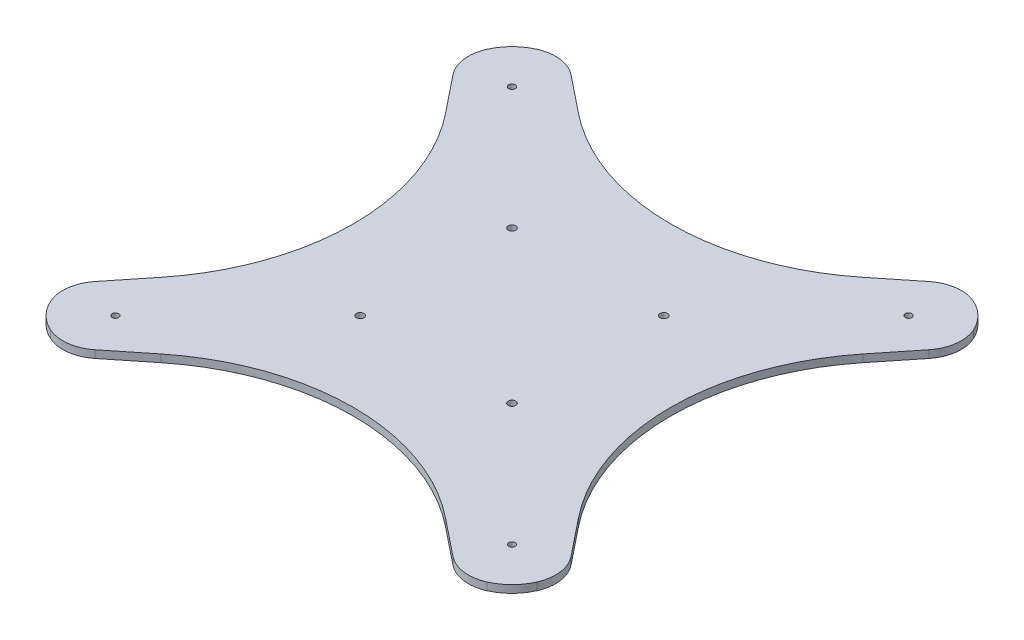
from build123d import *

# Parameters (mm, degrees)
EXTRUDE_3_DEPTH     = 4
FILLET_3_R          = 20
FILLET_4_R          = 20
FILLET_5_R          = 20
FILLET_6_R          = 20
FILLET_7_R          = 20
FILLET_8_R          = 20
FILLET_9_R          = 20
FILLET_10_R         = 20
SKETCH_6_R          = 1.75
CUT_EXTRUDE_3_DEPTH = 4
SKETCH_7_R          = 2
CUT_EXTRUDE_4_DEPTH = 4


with BuildPart() as part:
    # Эскиз5 → Бобышка-Вытянуть3 (new body)
    with BuildSketch(Plane(origin=(0, 0, 0), x_dir=(1, 0, 0), z_dir=(0, 1, 0))):
        with BuildLine():
            Line((-100, 130), (-74.963405707, 109.970724565))
            ThreePointArc((-74.963405707, 109.970724565), (0, 83.674981698), (74.963405707, 109.970724565))
            Line((74.963405707, 109.970724565), (100, 130))
            ThreePointArc((100, 130), (122.809833424, 122.809833424), (130, 100))
            Line((130, 100), (109.970724565, 74.963405707))
            ThreePointArc((109.970724565, 74.963405707), (83.674981698, 0), (109.970724565, -74.963405707))
            Line((109.970724565, -74.963405707), (130, -100))
            ThreePointArc((130, -100), (122.809833424, -122.809833424), (100, -130))
            Line((100, -130), (74.963405707, -109.970724565))
            ThreePointArc((74.963405707, -109.970724565), (0, -83.674981698), (-74.963405707, -109.970724565))
            Line((-74.963405707, -109.970724565), (-100, -130))
            ThreePointArc((-100, -130), (-122.809833424, -122.809833424), (-130, -100))
            Line((-130, -100), (-109.970724565, -74.963405707))
            ThreePointArc((-109.970724565, -74.963405707), (-83.674981698, 0), (-109.970724565, 74.963405707))
            Line((-109.970724565, 74.963405707), (-130, 100))
            ThreePointArc((-130, 100), (-122.809833424, 122.809833424), (-100, 130))
        make_face()
    extrude(amount=EXTRUDE_3_DEPTH)

    # Скругление3
    fillet_3_edges = [part.edges().sort_by_distance(p)[0] for p in [
        (130, 2, -100),
    ]]
    fillet(fillet_3_edges, radius=FILLET_3_R)

    # Скругление4
    fillet_4_edges = [part.edges().sort_by_distance(p)[0] for p in [
        (100, 2, -130),
    ]]
    fillet(fillet_4_edges, radius=FILLET_4_R)

    # Скругление5
    fillet_5_edges = [part.edges().sort_by_distance(p)[0] for p in [
        (-100, 2, -130),
    ]]
    fillet(fillet_5_edges, radius=FILLET_5_R)

    # Скругление6
    fillet_6_edges = [part.edges().sort_by_distance(p)[0] for p in [
        (-130, 2, -100),
    ]]
    fillet(fillet_6_edges, radius=FILLET_6_R)

    # Скругление7
    fillet_7_edges = [part.edges().sort_by_distance(p)[0] for p in [
        (-100, 2, 130),
    ]]
    fillet(fillet_7_edges, radius=FILLET_7_R)

    # Скругление8
    fillet_8_edges = [part.edges().sort_by_distance(p)[0] for p in [
        (-130, 2, 100),
    ]]
    fillet(fillet_8_edges, radius=FILLET_8_R)

    # Скругление9
    fillet_9_edges = [part.edges().sort_by_distance(p)[0] for p in [
        (100, 2, 130),
    ]]
    fillet(fillet_9_edges, radius=FILLET_9_R)

    # Скругление10
    fillet_10_edges = [part.edges().sort_by_distance(p)[0] for p in [
        (130, 2, 100),
    ]]
    fillet(fillet_10_edges, radius=FILLET_10_R)

    # Эскиз6 → Вырез-Вытянуть3 (cut)
    with BuildSketch(Plane(origin=(0, 4, 0), x_dir=(1, 0, 0), z_dir=(0, 1, 0))):
        with Locations(Location((-104.5, 104.5, 0), (0, 0, 270))):
            Circle(SKETCH_6_R)
        with Locations(Location((104.5, 104.5, 0), (0, 0, 270))):
            Circle(SKETCH_6_R)
        with Locations(Location((104.5, -104.5, 0), (0, 0, 270))):
            Circle(SKETCH_6_R)
        with Locations(Location((-104.5, -104.5, 0), (0, 0, 270))):
            Circle(SKETCH_6_R)
    extrude(amount=-CUT_EXTRUDE_3_DEPTH, mode=Mode.SUBTRACT)

    # Эскиз7 → Вырез-Вытянуть4 (cut)
    with BuildSketch(Plane(origin=(0, 4, 0), x_dir=(1, 0, 0), z_dir=(0, 1, 0))):
        with Locations(Location((-40, 40, 0), (0, 0, 270))):
            Circle(SKETCH_7_R)
        with Locations(Location((40, 40, 0), (0, 0, 270))):
            Circle(SKETCH_7_R)
        with Locations(Location((40, -40, 0), (0, 0, 270))):
            Circle(SKETCH_7_R)
        with Locations(Location((-40, -40, 0), (0, 0, 270))):
            Circle(SKETCH_7_R)
    extrude(amount=-CUT_EXTRUDE_4_DEPTH, mode=Mode.SUBTRACT)


solid = part.part
